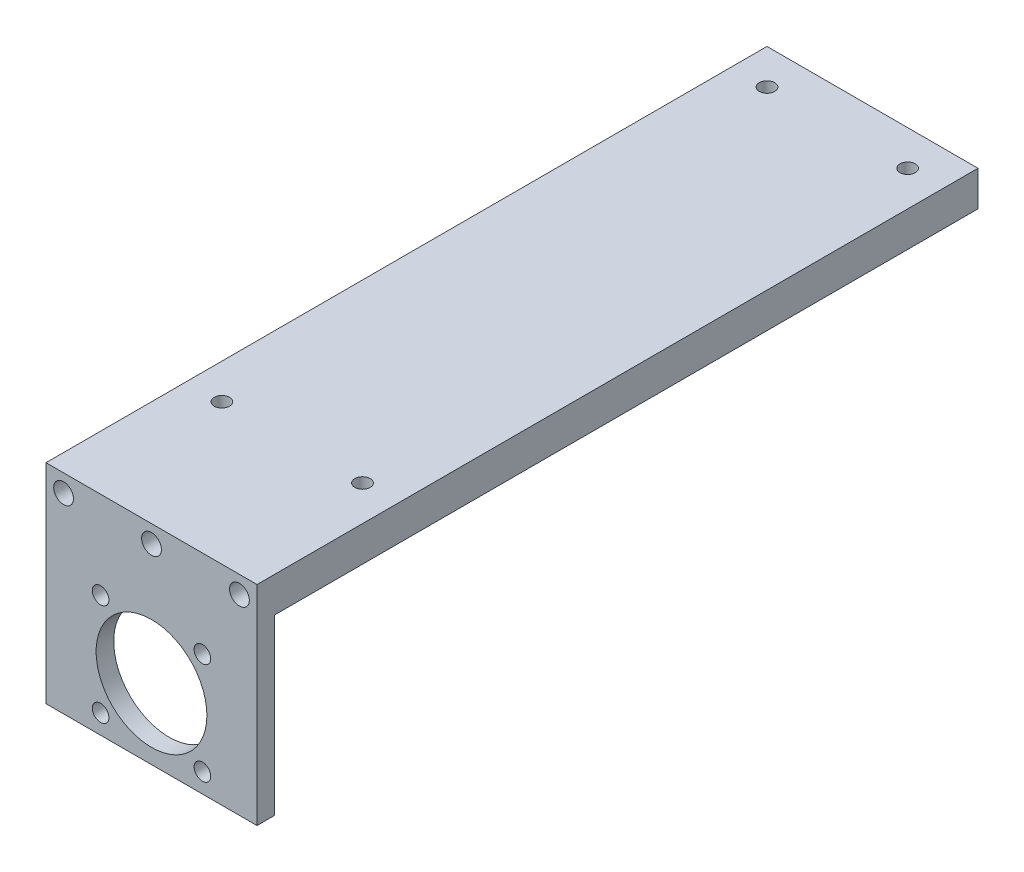
from build123d import *

# Parameters (mm, degrees)
SKETCH1_W           = 38.1
SKETCH1_H           = 37.6936
SKETCH1_R           = 10
SKETCH1_R_2         = 1.5
SKETCH1_R_3         = 1.7859375
BOSS_EXTRUDE1_DEPTH = 3.175
SKETCH2_W           = 38.1
SKETCH2_H           = 6.35
BOSS_EXTRUDE2_DEPTH = 127
CUT_EXTRUDE1_REACH  = 135.838
SKETCH3_R           = 1.3890625


with BuildPart() as part:
    # Sketch1 → Boss-Extrude1 (new body)
    with BuildSketch(Plane.XY):
        with Locations((0, 6.1468)):
            Rectangle(SKETCH1_W, SKETCH1_H)
        Circle(SKETCH1_R, mode=Mode.SUBTRACT)
        with Locations((-9.192388155, 9.192388155)):
            Circle(SKETCH1_R_2, mode=Mode.SUBTRACT)
        with Locations((9.192388155, 9.192388155)):
            Circle(SKETCH1_R_2, mode=Mode.SUBTRACT)
        with Locations((9.192388155, -9.192388155)):
            Circle(SKETCH1_R_2, mode=Mode.SUBTRACT)
        with Locations((-9.192388155, -9.192388155)):
            Circle(SKETCH1_R_2, mode=Mode.SUBTRACT)
        with Locations((15.875, 21.8186)):
            Circle(SKETCH1_R_3, mode=Mode.SUBTRACT)
        with Locations((0, 21.8186)):
            Circle(SKETCH1_R_3, mode=Mode.SUBTRACT)
        with Locations((-15.875, 21.8186)):
            Circle(SKETCH1_R_3, mode=Mode.SUBTRACT)
    extrude(amount=BOSS_EXTRUDE1_DEPTH)

    # Sketch2 → Boss-Extrude2 (add)
    with BuildSketch(Plane(origin=(0, 0, 0), x_dir=(-1, 0, 0), z_dir=(0, 0, -1))):
        with Locations((0, 21.8186)):
            Rectangle(SKETCH2_W, SKETCH2_H)
    extrude(amount=BOSS_EXTRUDE2_DEPTH)

    # Sketch3 → Cut-Extrude1 (cut, up to next)
    with BuildSketch(Plane(origin=(0, 24.9936, 0), x_dir=(1, 0, 0), z_dir=(0, 1, 0)), mode=Mode.PRIVATE) as cut_extrude1_sk1:
        with Locations(Location((-12.7, 120.65, 0), (0, 0, 180))):
            Circle(SKETCH3_R)
    cut_extrude1_tool1 = extrude(cut_extrude1_sk1.sketch, amount=-CUT_EXTRUDE1_REACH, mode=Mode.PRIVATE) & part.part
    # Sketch3 → Cut-Extrude1 (cut, up to next)
    with BuildSketch(Plane(origin=(0, 24.9936, 0), x_dir=(1, 0, 0), z_dir=(0, 1, 0)), mode=Mode.PRIVATE) as cut_extrude1_sk2:
        with Locations(Location((12.7, 120.65, 0), (0, 0, 180))):
            Circle(SKETCH3_R)
    cut_extrude1_tool2 = extrude(cut_extrude1_sk2.sketch, amount=-CUT_EXTRUDE1_REACH, mode=Mode.PRIVATE) & part.part
    # Sketch3 → Cut-Extrude1 (cut, up to next)
    with BuildSketch(Plane(origin=(0, 24.9936, 0), x_dir=(1, 0, 0), z_dir=(0, 1, 0)), mode=Mode.PRIVATE) as cut_extrude1_sk3:
        with Locations(Location((-12.7, 22.225, 0), (0, 0, 180))):
            Circle(SKETCH3_R)
    cut_extrude1_tool3 = extrude(cut_extrude1_sk3.sketch, amount=-CUT_EXTRUDE1_REACH, mode=Mode.PRIVATE) & part.part
    # Sketch3 → Cut-Extrude1 (cut, up to next)
    with BuildSketch(Plane(origin=(0, 24.9936, 0), x_dir=(1, 0, 0), z_dir=(0, 1, 0)), mode=Mode.PRIVATE) as cut_extrude1_sk4:
        with Locations(Location((12.7, 22.225, 0), (0, 0, 180))):
            Circle(SKETCH3_R)
    cut_extrude1_tool4 = extrude(cut_extrude1_sk4.sketch, amount=-CUT_EXTRUDE1_REACH, mode=Mode.PRIVATE) & part.part
    add(cut_extrude1_tool1.solids().sort_by_distance((-12.7, 24.9936, -120.65))[0], mode=Mode.SUBTRACT)
    add(cut_extrude1_tool2.solids().sort_by_distance((12.7, 24.9936, -120.65))[0], mode=Mode.SUBTRACT)
    add(cut_extrude1_tool3.solids().sort_by_distance((-12.7, 24.9936, -22.225))[0], mode=Mode.SUBTRACT)
    add(cut_extrude1_tool4.solids().sort_by_distance((12.7, 24.9936, -22.225))[0], mode=Mode.SUBTRACT)


solid = part.part
